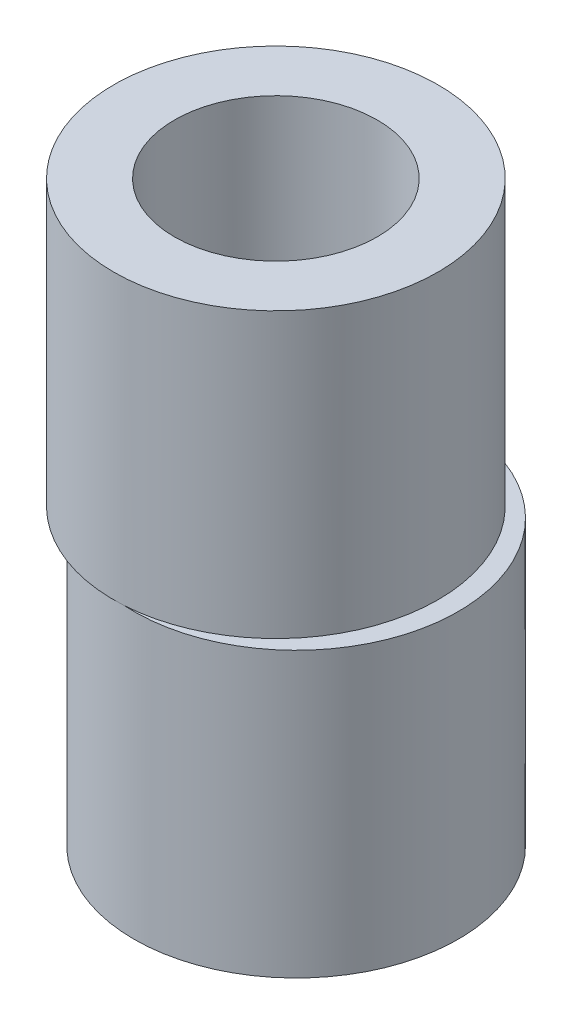
from build123d import *

# Parameters (mm, degrees)
SKETCH1_R           = 4
SKETCH1_R_2         = 2.5
BOSS_EXTRUDE1_DEPTH = 7
SKETCH2_R           = 4
SKETCH2_R_2         = 2.5
BOSS_EXTRUDE2_DEPTH = 7


with BuildPart() as part:
    # Sketch1 → Boss-Extrude1 (new body)
    with BuildSketch(Plane(origin=(0, 0, 0), x_dir=(1, 0, 0), z_dir=(0, 1, 0))):
        with Locations(Location((0, 0, 0), (0, 0, 270))):
            Circle(SKETCH1_R)
        with Locations(Location((0.5, 0, 0), (0, 0, 270))):
            Circle(SKETCH1_R_2, mode=Mode.SUBTRACT)
    extrude(amount=BOSS_EXTRUDE1_DEPTH)

    # Sketch2 → Boss-Extrude2 (add)
    with BuildSketch(Plane(origin=(0, 7, 0), x_dir=(1, 0, 0), z_dir=(0, 1, 0))):
        with Locations(Location((-0.5, 0, 0), (0, 0, 86.416678302))):
            Circle(SKETCH2_R)
        with Locations(Location((-0.5, 0, 0), (0, 0, 78.463040967))):
            Circle(SKETCH2_R_2, mode=Mode.SUBTRACT)
    extrude(amount=BOSS_EXTRUDE2_DEPTH)


solid = part.part
